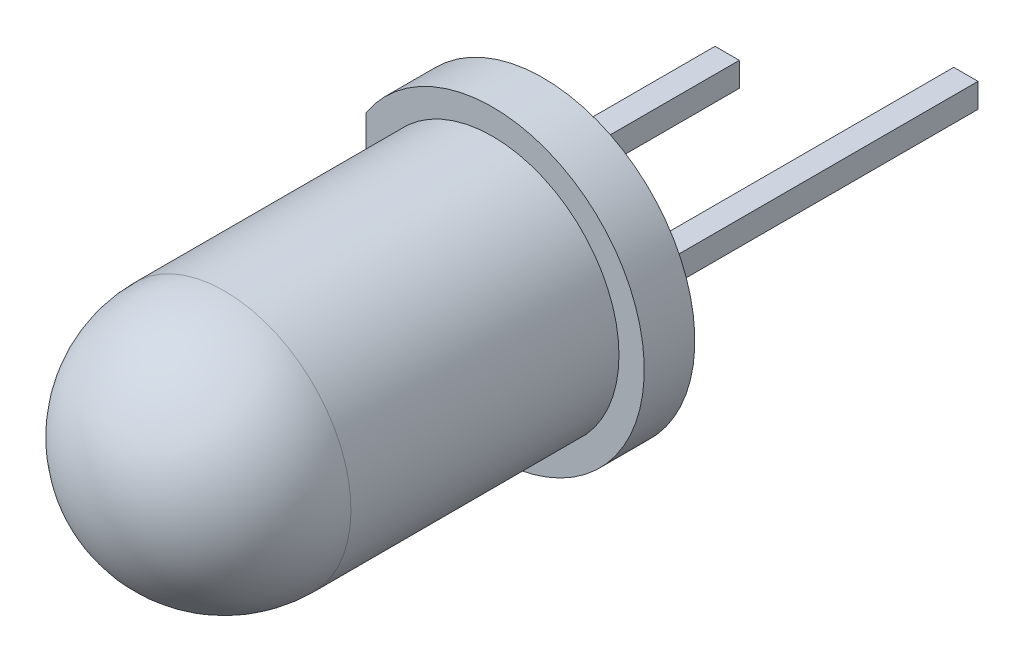
from build123d import *

# Parameters (mm, degrees)
SKETCH1_R             = 3
BOSS_EXTRUDE1_DEPTH   = 1
CUT_EXTRUDE1_DEPTH    = 1
SKETCH4_W             = 0.48
SKETCH4_H             = 0.48
BOSS_EXTRUDE2_DEPTH   = 5
BOSS_EXTRUDE2_2_DEPTH = 5
SKETCH5_W             = 0.48
SKETCH5_H             = 0.48
BOSS_EXTRUDE3_DEPTH   = 2
CUT_EXTRUDE2_DEPTH    = 0.24
BOSS_EXTRUDE4_DEPTH   = 0.24
BOSS_EXTRUDE4_2_DEPTH = 0.24
SKETCH10_R            = 0.2
CUT_EXTRUDE3_DEPTH    = 0.1


with BuildPart() as part:
    # Sketch1 → Boss-Extrude1 (new body)
    with BuildSketch(Plane.XY):
        Circle(SKETCH1_R)
    extrude(amount=BOSS_EXTRUDE1_DEPTH)

    # Sketch2 → Revolve1 (revolve)
    with BuildSketch(Plane(origin=(0, 0, 0), x_dir=(0, 0, -1), z_dir=(1, 0, 0))):
        with BuildLine():
            Line((-1, 0), (-8.8, 0))
            ThreePointArc((-8.8, 0), (-8.067766953, 1.767766953), (-6.3, 2.5))
            Line((-6.3, 2.5), (-1, 2.5))
            Line((-1, 2.5), (-1, 0))
        make_face()
    revolve(axis=Axis((0, 0, 1), (0, 0, 1)))

    # Sketch3 → Cut-Extrude1 (cut)
    with BuildSketch(Plane(origin=(0, 0, 0), x_dir=(-1, 0, 0), z_dir=(0, 0, -1))):
        with BuildLine():
            Line((2.5, 1.658312395), (2.5, -1.658312395))
            ThreePointArc((2.5, -1.658312395), (3, 0), (2.5, 1.658312395))
        make_face()
    extrude(amount=-CUT_EXTRUDE1_DEPTH, mode=Mode.SUBTRACT)

    # Sketch6 → Cut-Extrude2 (cut, symmetric)
    with BuildSketch(Plane(origin=(0, 0, 0), x_dir=(1, 0, 0), z_dir=(0, 1, 0))):
        Polygon((-1.6, 0), (-1.6, -3.5), (-1.3, -4), (1.2, -4), (0.02, -2), (-1.12, -2), (-1.12, 0), align=None)
        Polygon((1.6, 0), (1.6, -4), (1.4, -4), (0.22, -2), (1.12, -2), (1.12, 0), align=None)
    extrude(amount=CUT_EXTRUDE2_DEPTH, both=True, mode=Mode.SUBTRACT)


with BuildPart() as body_2:
    # Sketch4 → Boss-Extrude2 (new body)
    with BuildSketch(Plane(origin=(0, 0, 0), x_dir=(-1, 0, 0), z_dir=(0, 0, -1))):
        with Locations((-1.36, 0)):
            Rectangle(SKETCH4_W, SKETCH4_H)
    extrude(amount=BOSS_EXTRUDE2_DEPTH)


with BuildPart() as body_3:
    # Sketch4 → Boss-Extrude2 2 (new body)
    with BuildSketch(Plane(origin=(0, 0, 0), x_dir=(-1, 0, 0), z_dir=(0, 0, -1))):
        with Locations((1.36, 0)):
            Rectangle(SKETCH4_W, SKETCH4_H)
    extrude(amount=BOSS_EXTRUDE2_2_DEPTH)


with BuildPart() as body_4:
    # Sketch5 → Boss-Extrude3 (new body)
    with BuildSketch(Plane(origin=(0, 0, -5), x_dir=(-1, 0, 0), z_dir=(0, 0, -1))):
        with Locations((-1.36, 0)):
            Rectangle(SKETCH5_W, SKETCH5_H)
    extrude(amount=BOSS_EXTRUDE3_DEPTH)


with BuildPart() as body_5:
    # Sketch7 → Boss-Extrude4 (new, symmetric)
    with BuildSketch(Plane(origin=(0, 0, 0), x_dir=(1, 0, 0), z_dir=(0, 1, 0))):
        Polygon((-1.3, -4), (1.2, -4), (0.02, -2), (-1.12, -2), (-1.12, 0), (-1.6, 0), (-1.6, -3.5), align=None)
    extrude(amount=BOSS_EXTRUDE4_DEPTH, both=True)

    # Combine2: union body 3
    add(body_3.part)

    # Sketch8 → Cut-Revolve1 (revolve, cut)
    with BuildSketch(Plane(origin=(0, 0, 0), x_dir=(1, 0, 0), z_dir=(0, 1, 0))):
        with BuildLine():
            Line((-0.05, -4), (-0.05, -3.7))
            ThreePointArc((-0.05, -3.7), (-0.341547595, -3.780754009), (-0.55, -4))
            Line((-0.55, -4), (-0.05, -4))
        make_face()
    revolve(axis=Axis((-0.05, 0, 4), (0, 0, -1)), mode=Mode.SUBTRACT)


with BuildPart() as body_6:
    # Sketch7 → Boss-Extrude4 2 (new, symmetric)
    with BuildSketch(Plane(origin=(0, 0, 0), x_dir=(1, 0, 0), z_dir=(0, 1, 0))):
        Polygon((0.22, -2), (1.4, -4), (1.6, -4), (1.6, 0), (1.12, 0), (1.12, -2), align=None)
    extrude(amount=BOSS_EXTRUDE4_2_DEPTH, both=True)

    # Combine1: union body 4, body 2
    add(body_4.part)
    add(body_2.part)


with BuildPart() as body_4_2:
    # Sketch9 → Revolve2 (revolve)
    with BuildSketch(Plane(origin=(0, 0, 0), x_dir=(1, 0, 0), z_dir=(0, 1, 0))):
        with BuildLine():
            Line((-0.55, -4), (-0.05, -4))
            Line((-0.05, -4), (-0.05, -3.7))
            ThreePointArc((-0.05, -3.7), (-0.341547595, -3.780754009), (-0.55, -4))
        make_face()
    revolve(axis=Axis((-0.05, 0, 4), (0, 0, -1)))

    # Combine3: union body 5
    add(body_5.part)

    # Sketch10 → Cut-Extrude3 (cut)
    with BuildSketch(Plane.XY.offset(4)):
        with Locations((-0.05, 0)):
            Circle(SKETCH10_R)
    extrude(amount=-CUT_EXTRUDE3_DEPTH, mode=Mode.SUBTRACT)


solid = Compound([part.part, body_6.part, body_4_2.part])
